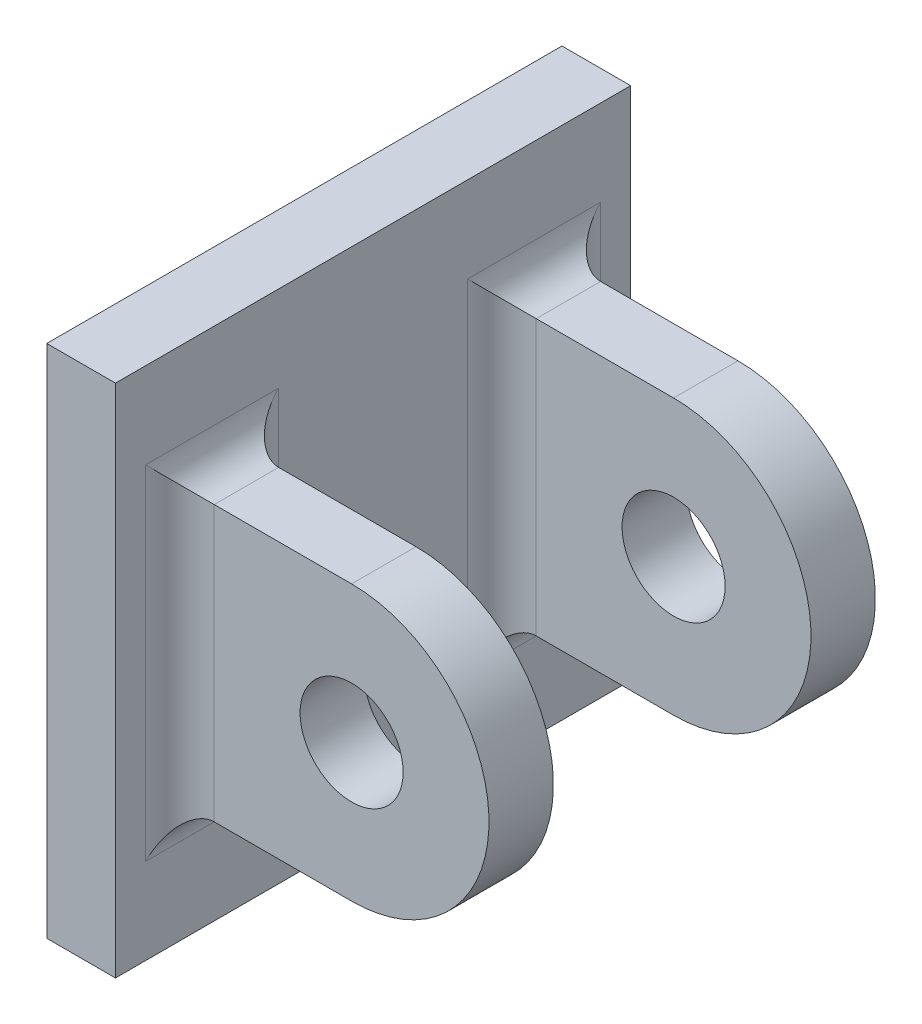
from build123d import *

# Parameters (mm, degrees)
SKETCH2_W           = 19.05
SKETCH2_H           = 19.05
BOSS_EXTRUDE2_DEPTH = 2.54
SKETCH3_W           = 2.38125
SKETCH3_H           = 10.16
BOSS_EXTRUDE3_DEPTH = 11.43
CUT_EXTRUDE1_DEPTH  = 29.912119026
SKETCH4_4_R         = 1.905
CUT_EXTRUDE2_DEPTH  = 29.912119026
FILLET3_R           = 1.27


with BuildPart() as part:
    # Sketch2 → Boss-Extrude2 (new body)
    with BuildSketch(Plane(origin=(0, 0, 0), x_dir=(0, 0, -1), z_dir=(1, 0, 0))):
        with Locations((9.525, 9.525)):
            Rectangle(SKETCH2_W, SKETCH2_H)
    extrude(amount=BOSS_EXTRUDE2_DEPTH)

    # Sketch3 → Boss-Extrude3 (add)
    with BuildSketch(Plane(origin=(2.54, 0, 0), x_dir=(0, 0, -1), z_dir=(1, 0, 0))):
        with Locations((3.571875, 9.525)):
            Rectangle(SKETCH3_W, SKETCH3_H)
        with Locations((15.478125, 9.525)):
            Rectangle(SKETCH3_W, SKETCH3_H)
    extrude(amount=BOSS_EXTRUDE3_DEPTH)

    # Sketch4 → Cut-Extrude1 (cut, through all)
    with BuildSketch(Plane.XY.offset(-2.38125)):
        with BuildLine():
            Line((13.97, 4.445), (13.97, 9.525))
            ThreePointArc((13.97, 9.525), (12.482102448, 5.932897552), (8.89, 4.445))
            Line((8.89, 4.445), (13.97, 4.445))
        make_face()
        with BuildLine():
            Line((13.97, 14.605), (8.89, 14.605))
            ThreePointArc((8.89, 14.605), (12.482102448, 13.117102448), (13.97, 9.525))
            Line((13.97, 9.525), (13.97, 14.605))
        make_face()
    extrude(amount=-CUT_EXTRUDE1_DEPTH, mode=Mode.SUBTRACT)

    # Sketch4<4> → Cut-Extrude2 (cut, through all)
    with BuildSketch(Plane.XY.offset(-2.38125)):
        with Locations((8.89, 9.525)):
            Circle(SKETCH4_4_R)
    extrude(amount=-CUT_EXTRUDE2_DEPTH, mode=Mode.SUBTRACT)

    # Fillet3
    fillet3_edges = [part.edges().sort_by_distance(p)[0] for p in [
        (2.54, 9.525, -14.2875),
        (2.54, 14.605, -15.478125),
        (2.54, 4.445, -15.478125),
        (2.54, 9.525, -16.66875),
        (2.54, 9.525, -4.7625),
        (2.54, 4.445, -3.571875),
        (2.54, 9.525, -2.38125),
        (2.54, 14.605, -3.571875),
    ]]
    fillet(fillet3_edges, radius=FILLET3_R)


solid = part.part
